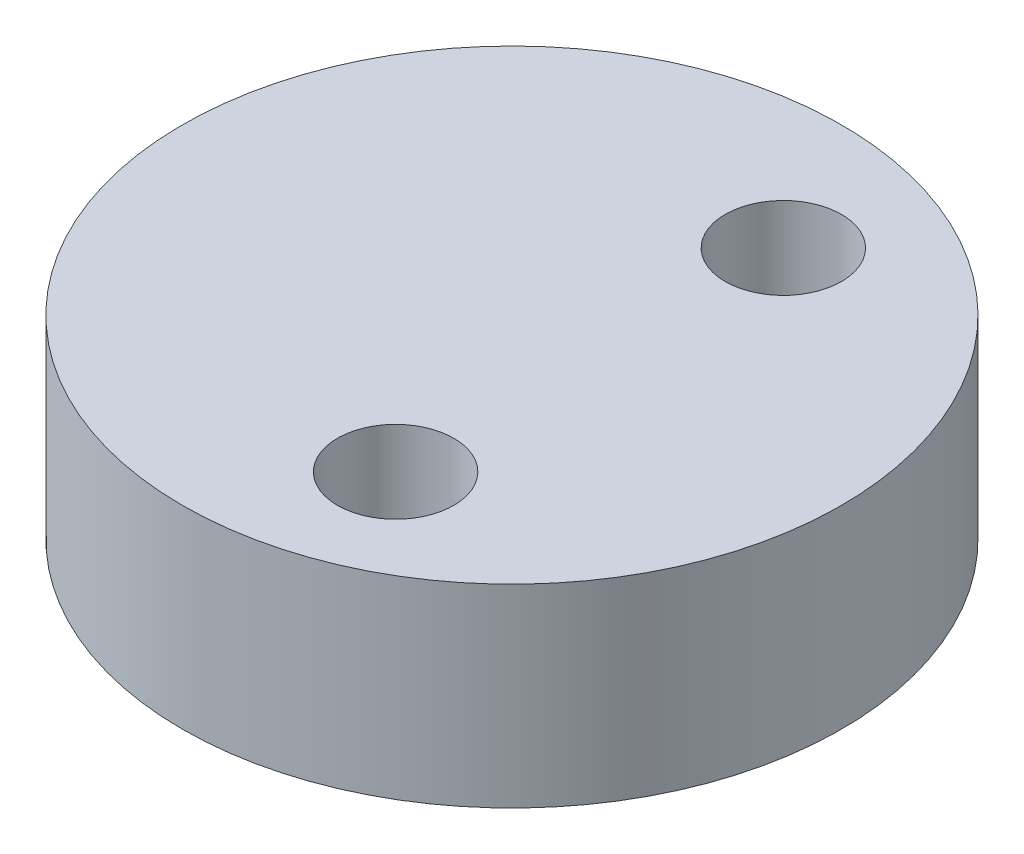
from build123d import *

# Parameters (mm, degrees)
SKETCH1_R           = 8.5
SKETCH1_R_2         = 1.5
BOSS_EXTRUDE1_DEPTH = 5


with BuildPart() as part:
    # Sketch1 → Boss-Extrude1 (new body)
    with BuildSketch(Plane(origin=(0, 0, 0), x_dir=(1, 0, 0), z_dir=(0, 1, 0))):
        with Locations(Location((-2, 0, 0), (0, 0, 270))):
            Circle(SKETCH1_R)
        with Locations(Location((0, 5, 0), (0, 0, 270))):
            Circle(SKETCH1_R_2, mode=Mode.SUBTRACT)
        with Locations(Location((0, -5, 0), (0, 0, 270))):
            Circle(SKETCH1_R_2, mode=Mode.SUBTRACT)
    extrude(amount=BOSS_EXTRUDE1_DEPTH)


solid = part.part
